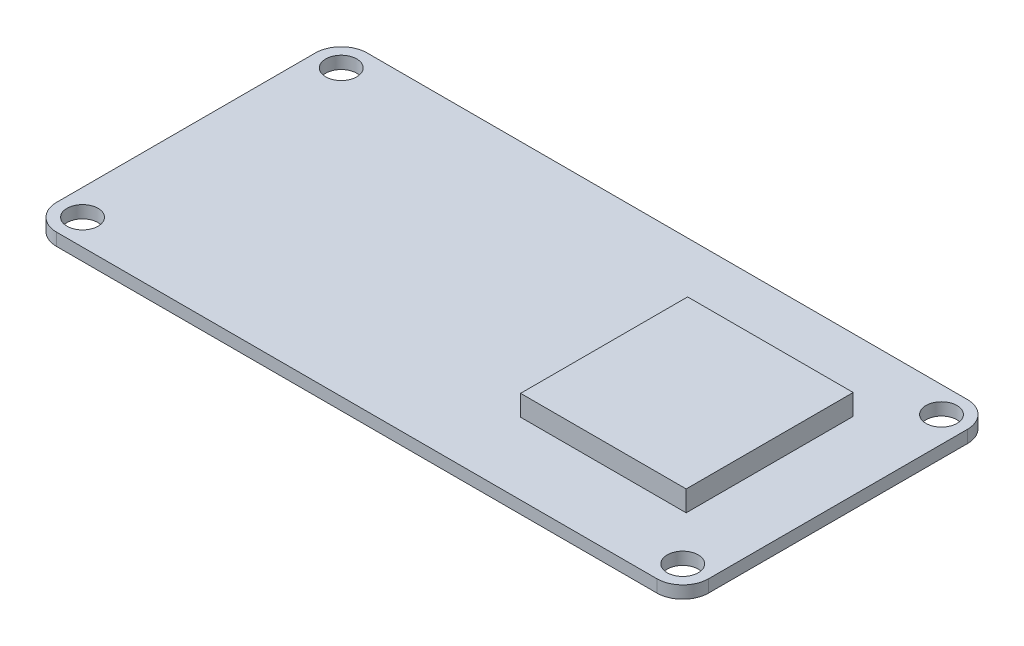
from build123d import *

# Parameters (mm, degrees)
SKETCH1_W           = 63
SKETCH1_H           = 30
SKETCH1_R           = 1.5
BOSS_EXTRUDE1_DEPTH = 1.2
FILLET1_R           = 2.5
SKETCH2_W           = 16
SKETCH2_H           = 16.140186368
BOSS_EXTRUDE2_DEPTH = 2


with BuildPart() as part:
    # Sketch1 → Boss-Extrude1 (new body)
    with BuildSketch(Plane(origin=(0, 0, 0), x_dir=(1, 0, 0), z_dir=(0, 1, 0))):
        with Locations((2.427241021, -1.312665963)):
            Rectangle(SKETCH1_W, SKETCH1_H)
        with Locations(Location((-26.572758979, 11.187334037, 0), (0, 0, 270))):
            Circle(SKETCH1_R, mode=Mode.SUBTRACT)
        with Locations(Location((-26.572758979, -13.812665963, 0), (0, 0, 270))):
            Circle(SKETCH1_R, mode=Mode.SUBTRACT)
        with Locations(Location((31.427241021, -13.812665963, 0), (0, 0, 270))):
            Circle(SKETCH1_R, mode=Mode.SUBTRACT)
        with Locations(Location((31.427241021, 11.187334037, 0), (0, 0, 270))):
            Circle(SKETCH1_R, mode=Mode.SUBTRACT)
    extrude(amount=BOSS_EXTRUDE1_DEPTH)

    # Fillet1
    fillet1_edges = [part.edges().sort_by_distance(p)[0] for p in [
        (-29.072758979, 0.6, -13.687334037),
        (33.927241021, 0.6, -13.687334037),
        (33.927241021, 0.6, 16.312665963),
        (-29.072758979, 0.6, 16.312665963),
    ]]
    fillet(fillet1_edges, radius=FILLET1_R)

    # Sketch2 → Boss-Extrude2 (add)
    with BuildSketch(Plane(origin=(0, 1.2, 0), x_dir=(1, 0, 0), z_dir=(0, 1, 0))):
        with Locations((19.327241021, -1.312665963)):
            Rectangle(SKETCH2_W, SKETCH2_H)
    extrude(amount=BOSS_EXTRUDE2_DEPTH)


solid = part.part
